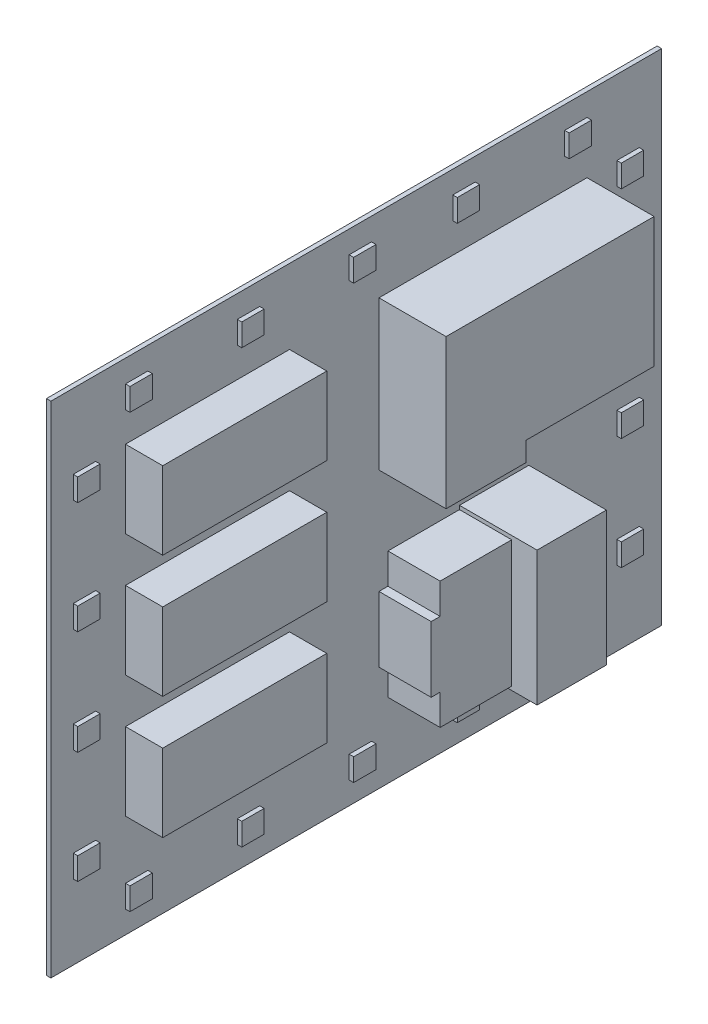
from build123d import *

# Parameters (mm, degrees)
SKETCH1_W           = 409.5
SKETCH1_H           = 335
BOSS_EXTRUDE1_DEPTH = 3
SKETCH1_3_W         = 110
SKETCH1_3_H         = 52
BOSS_EXTRUDE2_DEPTH = 28
BOSS_EXTRUDE3_DEPTH = 48
BOSS_EXTRUDE4_DEPTH = 38
BOSS_EXTRUDE5_DEPTH = 55
SKETCH1_9_W         = 6
SKETCH1_9_H         = 44
BOSS_EXTRUDE6_DEPTH = 38
SKETCH1_10_W        = 15
SKETCH1_10_H        = 15
BOSS_EXTRUDE7_DEPTH = 6


with BuildPart() as part:
    # Sketch1 → Boss-Extrude1 (new body)
    with BuildSketch(Plane(origin=(0, 0, 0), x_dir=(0, 0, -1), z_dir=(1, 0, 0))):
        with Locations((-15.25, -17.5)):
            Rectangle(SKETCH1_W, SKETCH1_H)
    extrude(amount=BOSS_EXTRUDE1_DEPTH)

    # Sketch1<3> → Boss-Extrude2 (add)
    with BuildSketch(Plane(origin=(0, 0, 0), x_dir=(0, 0, -1), z_dir=(1, 0, 0))):
        with Locations((-115, 74)):
            Rectangle(SKETCH1_3_W, SKETCH1_3_H)
        with Locations((-115, -8)):
            Rectangle(SKETCH1_3_W, SKETCH1_3_H)
        with Locations((-115, -90)):
            Rectangle(SKETCH1_3_W, SKETCH1_3_H)
    extrude(amount=BOSS_EXTRUDE2_DEPTH)

    # Sketch1<6> → Boss-Extrude3 (add)
    with BuildSketch(Plane(origin=(0, 0, 0), x_dir=(0, 0, -1), z_dir=(1, 0, 0))):
        Polygon((139.5, 100), (0, 100), (0, 0), (53.5, 0), (53.5, 13), (139.5, 13), align=None)
    extrude(amount=BOSS_EXTRUDE3_DEPTH)

    # Sketch1<7> → Boss-Extrude4 (add)
    with BuildSketch(Plane(origin=(0, 0, 0), x_dir=(0, 0, -1), z_dir=(1, 0, 0))):
        Polygon((54, -50), (6, -50), (6, -70.5), (6, -114.5), (6, -135), (54, -135), align=None)
    extrude(amount=BOSS_EXTRUDE4_DEPTH)

    # Sketch1<8> → Boss-Extrude5 (add)
    with BuildSketch(Plane(origin=(0, 0, 0), x_dir=(0, 0, -1), z_dir=(1, 0, 0))):
        Polygon((54, -47.5), (54, -50), (54, -135), (54, -137.5), (100.5, -137.5), (100.5, -114.5), (100.5, -70.5), (100.5, -47.5), align=None)
    extrude(amount=BOSS_EXTRUDE5_DEPTH)

    # Sketch1<9> → Boss-Extrude6 (add)
    with BuildSketch(Plane(origin=(0, 0, 0), x_dir=(0, 0, -1), z_dir=(1, 0, 0))):
        with Locations((3, -92.5)):
            Rectangle(SKETCH1_9_W, SKETCH1_9_H)
        with Locations((103.5, -92.5)):
            Rectangle(SKETCH1_9_W, SKETCH1_9_H)
    extrude(amount=BOSS_EXTRUDE6_DEPTH)

    # Sketch1<10> → Boss-Extrude7 (add)
    with BuildSketch(Plane(origin=(0, 0, 0), x_dir=(0, 0, -1), z_dir=(1, 0, 0))):
        with Locations((-197.5, 92.5)):
            Rectangle(SKETCH1_10_W, SKETCH1_10_H)
        with Locations((-197.5, -127.5)):
            Rectangle(SKETCH1_10_W, SKETCH1_10_H)
        with Locations((-197.5, -52.5)):
            Rectangle(SKETCH1_10_W, SKETCH1_10_H)
        with Locations((-197.5, 17.5)):
            Rectangle(SKETCH1_10_W, SKETCH1_10_H)
        with Locations((-162.5, -162.5)):
            Rectangle(SKETCH1_10_W, SKETCH1_10_H)
        with Locations((-87.5, -162.5)):
            Rectangle(SKETCH1_10_W, SKETCH1_10_H)
        with Locations((-12.5, -162.5)):
            Rectangle(SKETCH1_10_W, SKETCH1_10_H)
        with Locations((132, -162.5)):
            Rectangle(SKETCH1_10_W, SKETCH1_10_H)
        with Locations((57, -162.5)):
            Rectangle(SKETCH1_10_W, SKETCH1_10_H)
        with Locations((167, 92.5)):
            Rectangle(SKETCH1_10_W, SKETCH1_10_H)
        with Locations((167, 17.5)):
            Rectangle(SKETCH1_10_W, SKETCH1_10_H)
        with Locations((167, -52.5)):
            Rectangle(SKETCH1_10_W, SKETCH1_10_H)
        with Locations((167, -127.5)):
            Rectangle(SKETCH1_10_W, SKETCH1_10_H)
        with Locations((-162.5, 127.5)):
            Rectangle(SKETCH1_10_W, SKETCH1_10_H)
        with Locations((-87.5, 127.5)):
            Rectangle(SKETCH1_10_W, SKETCH1_10_H)
        with Locations((57, 127.5)):
            Rectangle(SKETCH1_10_W, SKETCH1_10_H)
        with Locations((132, 127.5)):
            Rectangle(SKETCH1_10_W, SKETCH1_10_H)
        with Locations((-12.5, 127.5)):
            Rectangle(SKETCH1_10_W, SKETCH1_10_H)
    extrude(amount=BOSS_EXTRUDE7_DEPTH)


solid = part.part
